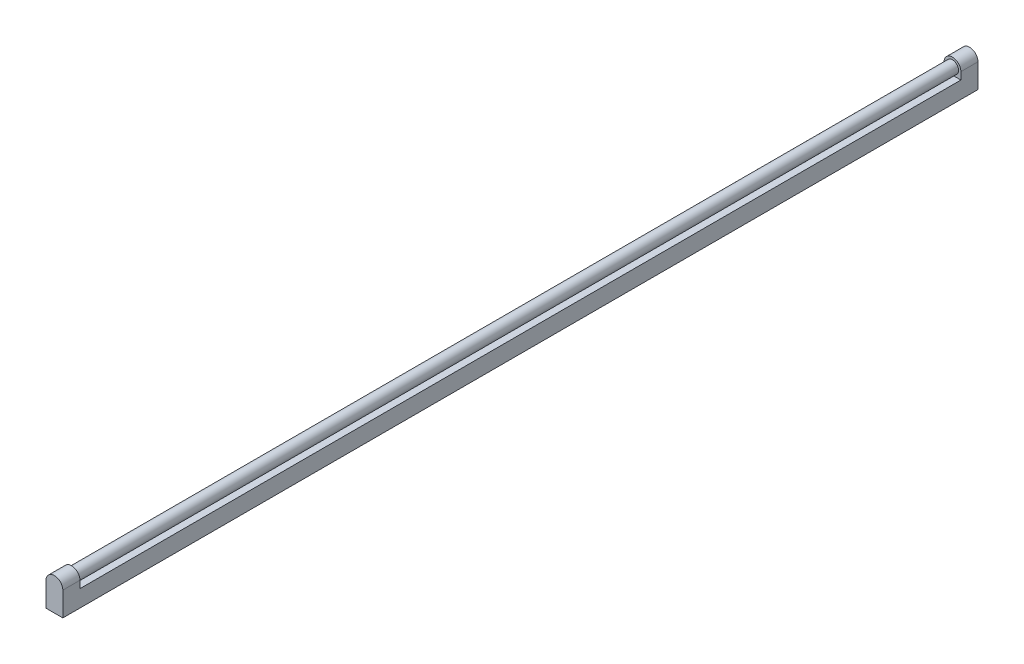
from build123d import *

# Parameters (mm, degrees)
SKETCH1_R           = 10.922
SKETCH1_W           = 21.844
SKETCH1_H           = 21.844
BOSS_EXTRUDE1_DEPTH = 22.225
SKETCH2_R           = 7.9375
SKETCH2_W           = 21.844
SKETCH2_H           = 21.844
BOSS_EXTRUDE2_DEPTH = 571.5
BOSS_EXTRUDE3_START = 22.225
SKETCH3_R           = 10.922
SKETCH3_R_2         = 7.9375
BOSS_EXTRUDE3_DEPTH = 22.225


with BuildPart() as part:
    # Sketch1 → Boss-Extrude1 (new body)
    with BuildSketch(Plane.XY):
        with BuildLine():
            Line((0, 9.398), (0, 0))
            Line((0, 0), (5.357138816, 0))
            ThreePointArc((5.357138816, 0), (1.433335767, 3.989179882), (0, 9.398))
        make_face()
        with BuildLine():
            ThreePointArc((0, 9.398), (1.433335767, 3.989179882), (5.357138816, 0))
            Line((5.357138816, 0), (10.922, 0))
            Line((10.922, 0), (10.922, 9.398))
            Line((10.922, 9.398), (10.922, 20.32))
            ThreePointArc((10.922, 20.32), (3.198979736, 17.121020264), (0, 9.398))
        make_face()
        with BuildLine():
            Line((10.922, 9.398), (10.922, 0))
            Line((10.922, 0), (16.486861184, 0))
            ThreePointArc((16.486861184, 0), (20.410664233, 3.989179882), (21.844, 9.398))
            ThreePointArc((21.844, 9.398), (18.645020264, 17.121020264), (10.922, 20.32))
            Line((10.922, 20.32), (10.922, 9.398))
        make_face()
        with BuildLine():
            ThreePointArc((21.844, 9.398), (20.410664233, 3.989179882), (16.486861184, 0))
            Line((16.486861184, 0), (21.844, 0))
            Line((21.844, 0), (21.844, 9.398))
        make_face()
        with BuildLine():
            Line((10.922, 0), (5.357138816, 0))
            ThreePointArc((5.357138816, 0), (10.922, -1.524), (16.486861184, 0))
            Line((16.486861184, 0), (10.922, 0))
        make_face()
        with Locations((10.922, 9.398)):
            Circle(SKETCH1_R)
        with Locations((10.922, -10.922)):
            Rectangle(SKETCH1_W, SKETCH1_H)
    extrude(amount=BOSS_EXTRUDE1_DEPTH)

    # Sketch2 → Boss-Extrude2 (add)
    with BuildSketch(Plane(origin=(0, 0, 0), x_dir=(-1, 0, 0), z_dir=(0, 0, -1))):
        with Locations(Location((-10.922, 9.398, 0), (0, 0, 180))):
            Circle(SKETCH2_R)
        with Locations((-10.922, -10.922)):
            Rectangle(SKETCH2_W, SKETCH2_H)
    boss_extrude2 = extrude(amount=BOSS_EXTRUDE2_DEPTH)

    # Mirror1: Boss-Extrude2 across plane
    add(boss_extrude2.mirror(Plane.XY.offset(-571.5)))

    # Sketch3 → Boss-Extrude3 (add)
    # profile 1 of 3: a face of its own
    with BuildSketch(Plane(origin=(0, 0, -1143), x_dir=(-1, 0, 0), z_dir=(0, 0, -1)).offset(BOSS_EXTRUDE3_START)):
        with BuildLine():
            Line((-21.844, -21.844), (0, -21.844))
            Line((0, -21.844), (0, 9.398))
            ThreePointArc((0, 9.398), (-10.922, -1.524), (-21.844, 9.398))
            Line((-21.844, 9.398), (-21.844, -21.844))
        make_face()
    # profile 2 of 3: a face of its own
    with BuildSketch(Plane(origin=(0, 0, -1143), x_dir=(-1, 0, 0), z_dir=(0, 0, -1)).offset(BOSS_EXTRUDE3_START)):
        with Locations((-10.922, 9.398)):
            Circle(SKETCH3_R)
        with Locations(Location((-10.922, 9.398, 0), (0, 0, 180))):
            Circle(SKETCH3_R_2, mode=Mode.SUBTRACT)
    # profile 3 of 3: a face of its own
    with BuildSketch(Plane(origin=(0, 0, -1143), x_dir=(-1, 0, 0), z_dir=(0, 0, -1)).offset(BOSS_EXTRUDE3_START)):
        with Locations(Location((-10.922, 9.398, 0), (0, 0, 180))):
            Circle(SKETCH3_R_2)
    extrude(amount=-BOSS_EXTRUDE3_DEPTH)


solid = part.part
